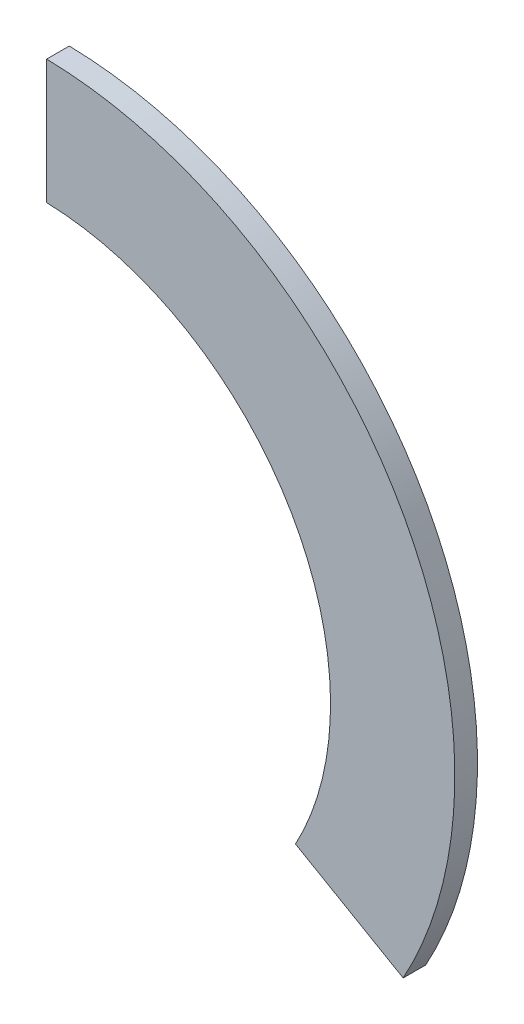
from build123d import *

# Parameters (mm, degrees)
BOSS_EXTRU_1_DEPTH = 4


with BuildPart() as part:
    # Esquisse1 → Boss.-Extru.1 (new body)
    with BuildSketch(Plane.XY):
        with BuildLine():
            Line((1.5, 73.594715164), (1.5, 51.628214186))
            ThreePointArc((1.5, 51.628214186), (44.730231579, 25.824966271), (45.461308065, -24.515137548))
            Line((45.461308065, -24.515137548), (64.48485536, -35.498387699))
            ThreePointArc((64.48485536, -35.498387699), (63.748149442, 36.804966278), (1.5, 73.594715164))
        make_face()
    extrude(amount=BOSS_EXTRU_1_DEPTH)


solid = part.part
